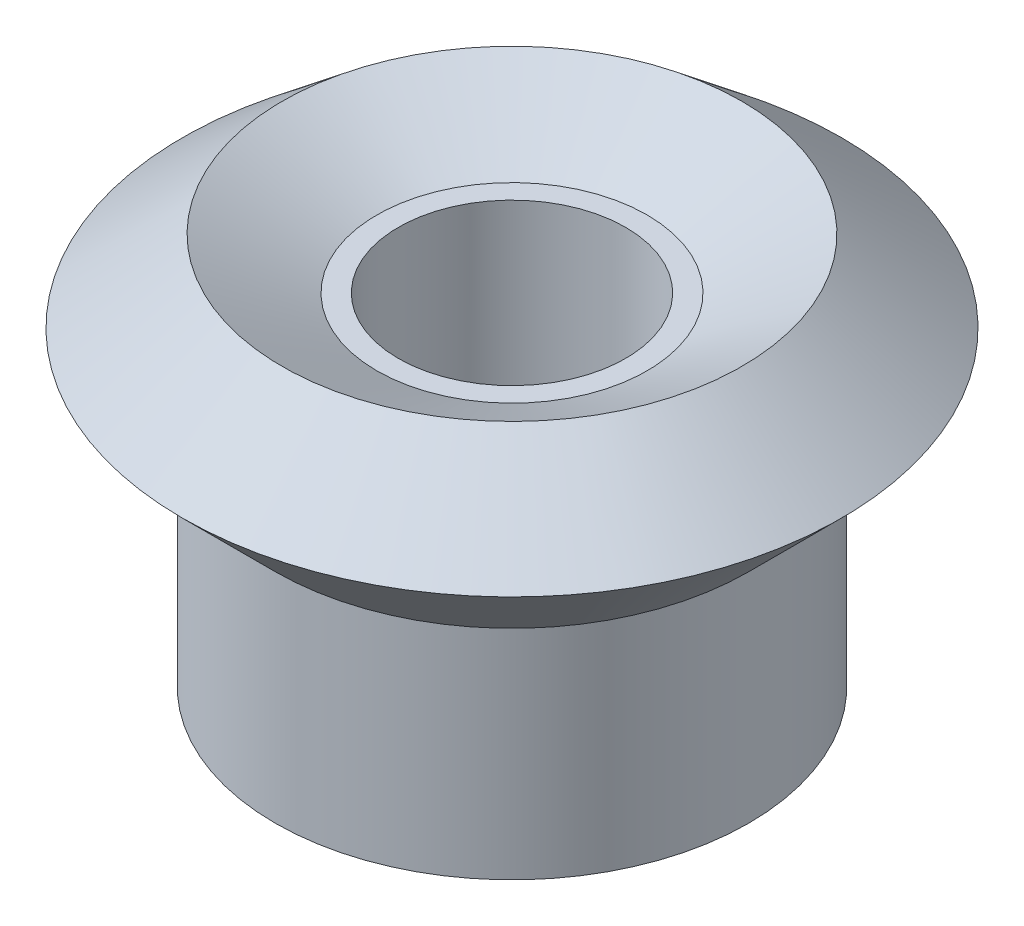
from build123d import *

# Parameters (mm, degrees)
SKETCH2_R          = 6
CUT_EXTRUDE1_DEPTH = 33.156025874


with BuildPart() as part:
    # Sketch1 → Revolve1 (revolve)
    with BuildSketch(Plane.XY, mode=Mode.PRIVATE) as revolve1_sk:
        Polygon((17.4, 16.4), (12.132173, 20.7), (7.132173, 18), (5, 18), (5, 0), (12.5, 0), (12.5, 11.5), align=None)
    revolve(revolve1_sk.sketch.rotate(Axis((0, 20.7, 0), (0, -1, 0)), 270), axis=Axis((0, 20.7, 0), (0, -1, 0)))

    # Sketch2 → Cut-Extrude1 (cut, through all)
    with BuildSketch(Plane.XZ):
        with Locations(Location((0, 0, 0), (0, 0, 270))):
            Circle(SKETCH2_R)
    extrude(amount=-CUT_EXTRUDE1_DEPTH, mode=Mode.SUBTRACT)


solid = part.part
